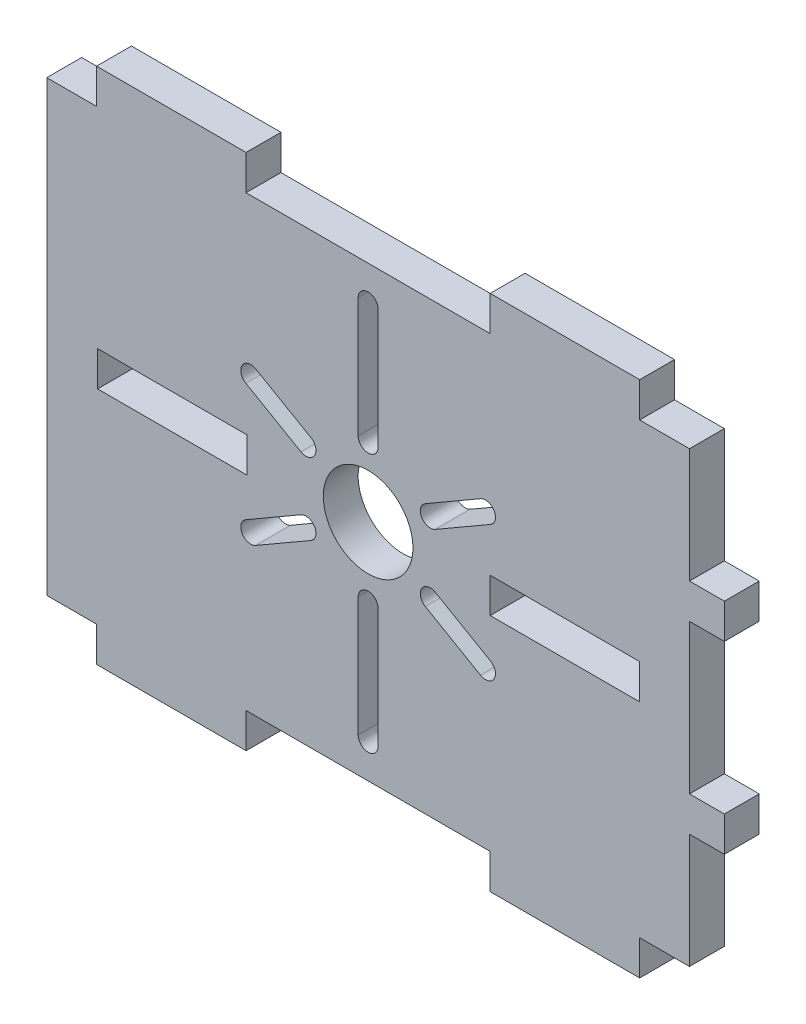
from build123d import *

# Parameters (mm, degrees)
SKETCH1_R           = 4.5
BOSS_EXTRUDE1_DEPTH = 3.5
SKETCH2_W           = 15
SKETCH2_H           = 3.5
CUT_EXTRUDE1_DEPTH  = 45.343122353


with BuildPart() as part:
    # Sketch1 → Boss-Extrude1 (new body)
    with BuildSketch(Plane.XY):
        Polygon((27.25, -26), (27.25, -22.5), (32.25, -22.5), (32.25, -11), (35.75, -11), (35.75, -7.5), (32.25, -7.5), (32.25, 7.5), (35.75, 7.5), (35.75, 11), (32.25, 11), (32.25, 22.5), (27.25, 22.5), (27.25, 26), (12.25, 26), (12.25, 22.5), (-12.25, 22.5), (-12.25, 26), (-27.25, 26), (-27.25, 22.5), (-32.25, 22.5), (-32.25, -22.5), (-27.25, -22.5), (-27.25, -26), (-12.25, -26), (-12.25, -22.5), (12.25, -22.5), (12.25, -26), align=None)
        Circle(SKETCH1_R, mode=Mode.SUBTRACT)
        with BuildLine():
            Line((-11.277098909, -7.667491727), (-5.734536325, -4.467491727))
            ThreePointArc((-5.734536325, -4.467491727), (-5.36789118, -3.099153418), (-6.736229489, -2.732508273))
            Line((-6.736229489, -2.732508273), (-12.278792074, -5.932508273))
            ThreePointArc((-12.278792074, -5.932508273), (-12.645437219, -7.300846582), (-11.277098909, -7.667491727))
        make_face(mode=Mode.SUBTRACT)
        with BuildLine():
            Line((1, 19), (1, 7))
            ThreePointArc((1, 7), (0, 6), (-1, 7))
            Line((-1, 7), (-1, 19))
            ThreePointArc((-1, 19), (0, 20), (1, 19))
        make_face(mode=Mode.SUBTRACT)
        with BuildLine():
            Line((-12.278792074, 5.932508273), (-6.736229489, 2.732508273))
            ThreePointArc((-6.736229489, 2.732508273), (-5.36789118, 3.099153418), (-5.734536325, 4.467491727))
            Line((-5.734536325, 4.467491727), (-11.277098909, 7.667491727))
            ThreePointArc((-11.277098909, 7.667491727), (-12.645437219, 7.300846582), (-12.278792074, 5.932508273))
        make_face(mode=Mode.SUBTRACT)
        with BuildLine():
            Line((11.277098909, 7.667491727), (5.734536325, 4.467491727))
            ThreePointArc((5.734536325, 4.467491727), (5.36789118, 3.099153418), (6.736229489, 2.732508273))
            Line((6.736229489, 2.732508273), (12.278792074, 5.932508273))
            ThreePointArc((12.278792074, 5.932508273), (12.645437219, 7.300846582), (11.277098909, 7.667491727))
        make_face(mode=Mode.SUBTRACT)
        with BuildLine():
            Line((12.278792074, -5.932508273), (6.736229489, -2.732508273))
            ThreePointArc((6.736229489, -2.732508273), (5.36789118, -3.099153418), (5.734536325, -4.467491727))
            Line((5.734536325, -4.467491727), (11.277098909, -7.667491727))
            ThreePointArc((11.277098909, -7.667491727), (12.645437219, -7.300846582), (12.278792074, -5.932508273))
        make_face(mode=Mode.SUBTRACT)
        with BuildLine():
            Line((1, -19), (1, -7))
            ThreePointArc((1, -7), (0, -6), (-1, -7))
            Line((-1, -7), (-1, -19))
            ThreePointArc((-1, -19), (0, -20), (1, -19))
        make_face(mode=Mode.SUBTRACT)
    extrude(amount=BOSS_EXTRUDE1_DEPTH)

    # Sketch2 → Cut-Extrude1 (cut, through all)
    with BuildSketch(Plane(origin=(0, 0, 0), x_dir=(-1, 0, 0), z_dir=(0, 0, -1))):
        with Locations((19.65, -0.25)):
            Rectangle(SKETCH2_W, SKETCH2_H)
        with Locations((-19.75, -0.25)):
            Rectangle(SKETCH2_W, SKETCH2_H)
    extrude(amount=-CUT_EXTRUDE1_DEPTH, mode=Mode.SUBTRACT)


solid = part.part
